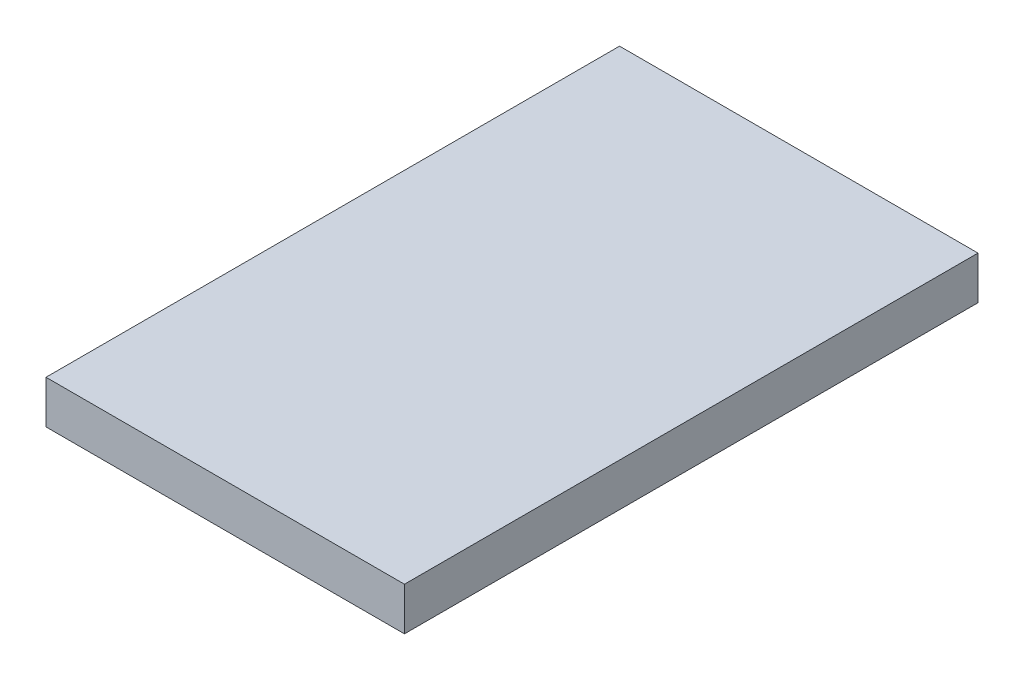
from build123d import *

# Parameters (mm, degrees)
SKETCH1_W           = 25
SKETCH1_H           = 40
BOSS_EXTRUDE1_DEPTH = 3


with BuildPart() as part:
    # Sketch1 → Boss-Extrude1 (new body)
    with BuildSketch(Plane(origin=(0, 0, 0), x_dir=(1, 0, 0), z_dir=(0, 1, 0))):
        Rectangle(SKETCH1_W, SKETCH1_H)
    extrude(amount=BOSS_EXTRUDE1_DEPTH)


solid = part.part
